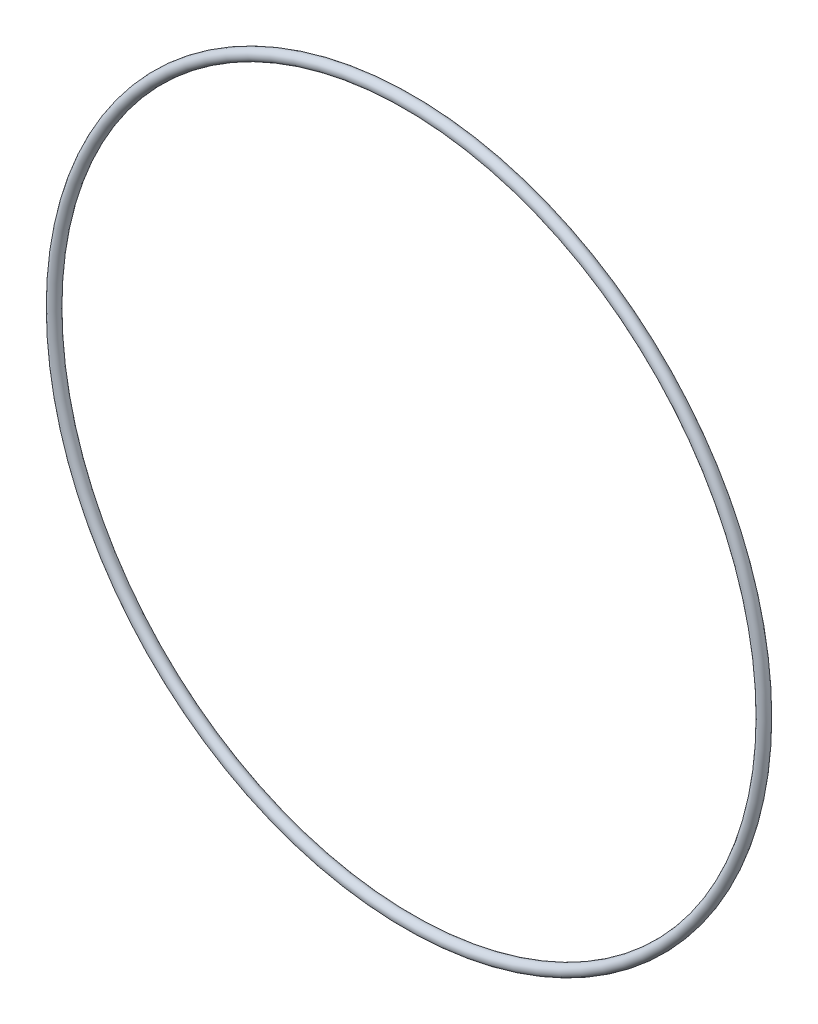
from build123d import *

# Parameters (mm, degrees)
SKETCH1_R = 1.3081


with BuildPart() as part:
    # Sketch1 → Revolve1 (revolve)
    with BuildSketch(Plane(origin=(0, 0, 0), x_dir=(0, -1, 0), z_dir=(1, 0, 0)), mode=Mode.PRIVATE) as revolve1_sk:
        with Locations((83.693, 0)):
            Circle(SKETCH1_R)
    revolve(revolve1_sk.sketch.rotate(Axis((0, 0, 1.3081), (0, 0, -1)), 270), axis=Axis((0, 0, 1.3081), (0, 0, -1)))


solid = part.part
